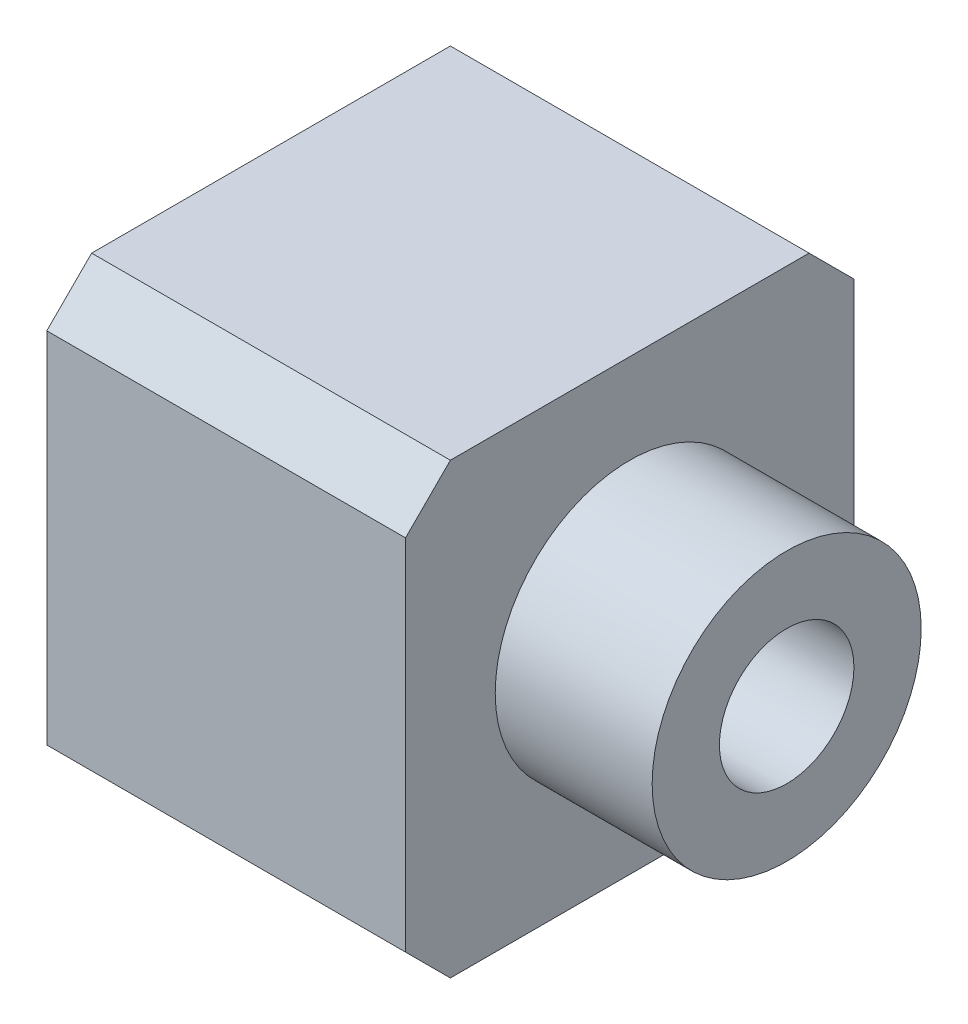
from build123d import *

# Parameters (mm, degrees)
SKETCH1_W           = 10
SKETCH1_H           = 10
BOSS_EXTRUDE1_DEPTH = 13.5
SKETCH2_R           = 15.353568197
SKETCH2_R_2         = 3
CUT_EXTRUDE1_DEPTH  = 3.5
CUT_EXTRUDE2_START  = -2
SKETCH3_R           = 15.635411304
SKETCH3_R_2         = 3
CUT_EXTRUDE2_DEPTH  = 2
SKETCH4_R           = 1.5
CUT_EXTRUDE3_DEPTH  = 16.239750654
CHAMFER1_SIZE       = 1
CUT_EXTRUDE4_START  = 5
SKETCH5_R           = 1.5
CUT_EXTRUDE4_DEPTH  = 2


with BuildPart() as part:
    # Sketch1 → Boss-Extrude1 (new body)
    with BuildSketch(Plane(origin=(0, 0, 0), x_dir=(0, 0, -1), z_dir=(1, 0, 0))):
        Rectangle(SKETCH1_W, SKETCH1_H)
    extrude(amount=-BOSS_EXTRUDE1_DEPTH)

    # Sketch2 → Cut-Extrude1 (cut)
    with BuildSketch(Plane(origin=(0, 0, 0), x_dir=(0, 0, -1), z_dir=(1, 0, 0))):
        Circle(SKETCH2_R)
        Circle(SKETCH2_R_2, mode=Mode.SUBTRACT)
    extrude(amount=-CUT_EXTRUDE1_DEPTH, mode=Mode.SUBTRACT)

    # Sketch3 → Cut-Extrude2 (cut)
    with BuildSketch(Plane.ZY.offset(13.5).offset(CUT_EXTRUDE2_START)):
        Circle(SKETCH3_R)
        with Locations(Location((0, 0, 0), (0, 0, 180))):
            Circle(SKETCH3_R_2, mode=Mode.SUBTRACT)
    extrude(amount=CUT_EXTRUDE2_DEPTH, mode=Mode.SUBTRACT)

    # Sketch4 → Cut-Extrude3 (cut, through all)
    with BuildSketch(Plane(origin=(0, 0, 0), x_dir=(0, 0, -1), z_dir=(1, 0, 0))):
        Circle(SKETCH4_R)
    extrude(amount=-CUT_EXTRUDE3_DEPTH, mode=Mode.SUBTRACT)

    # Chamfer1
    chamfer1_edges = [part.edges().sort_by_distance(p)[0] for p in [
        (-7.5, -5, -5),
        (-7.5, -5, 5),
        (-7.5, 5, -5),
        (-7.5, 5, 5),
    ]]
    chamfer(chamfer1_edges, length=CHAMFER1_SIZE)

    # Sketch5 → Cut-Extrude4 (cut)
    with BuildSketch(Plane(origin=(0, 0, 0), x_dir=(-1, 0, 0), z_dir=(0, 0, -1)).offset(CUT_EXTRUDE4_START)):
        with Locations((7.5, 0)):
            Circle(SKETCH5_R)
    extrude(amount=-CUT_EXTRUDE4_DEPTH, mode=Mode.SUBTRACT)


solid = part.part
